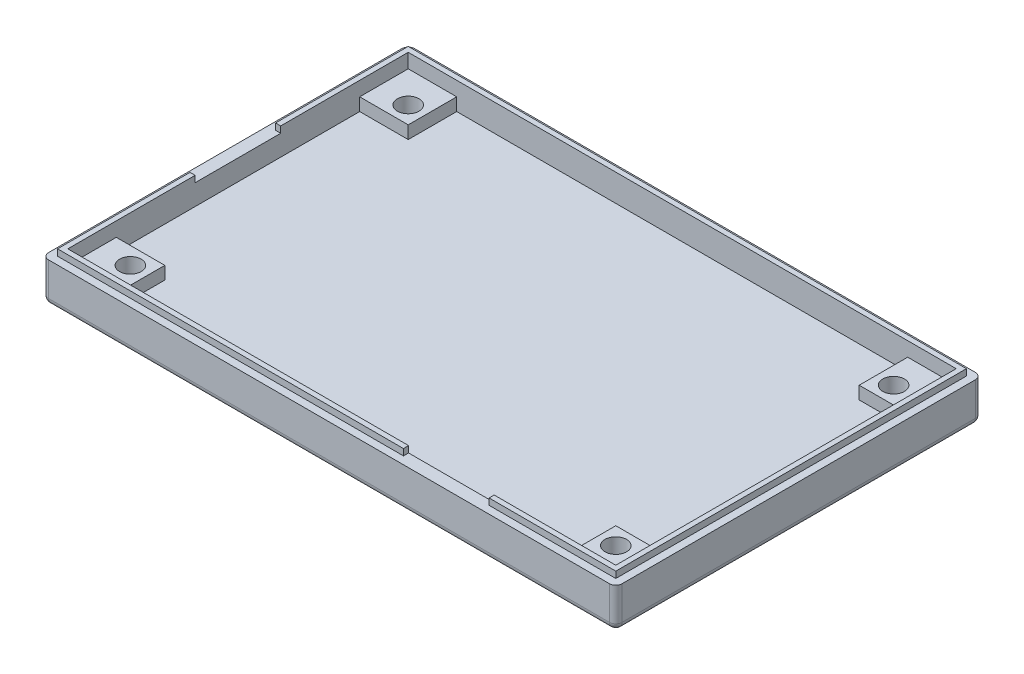
from build123d import *

# Parameters (mm, degrees)
SKETCH1_W               = 114.045996948
SKETCH1_H               = 72.771003052
SKETCH1_W_2             = 108.965996948
SKETCH1_H_2             = 67.691003052
BOSS_EXTRUDE1_DEPTH     = 5.3848
SKETCH2_W               = 114.045996948
SKETCH2_H               = 72.771003052
BOSS_EXTRUDE2_DEPTH     = 2.54
SKETCH3_W               = 9.64565
SKETCH3_H               = 9.645653052
BOSS_EXTRUDE3_DEPTH     = 3.81
CUT_EXTRUDE1_DEPTH      = 132.233284578
CUT_EXTRUDE1_DEPTH_BACK = 76.2
SKETCH4_R               = 2.1499957
SKETCH5_R               = 3.8735
CUT_EXTRUDE2_DEPTH      = 2.54
BOSS_EXTRUDE4_DEPTH     = 1.27
BOSS_EXTRUDE5_DEPTH     = 1.27
FILLET1_R               = 1.27


with BuildPart() as part:
    # Sketch1 → Boss-Extrude1 (new body)
    with BuildSketch(Plane(origin=(0, 0, 0), x_dir=(1, 0, 0), z_dir=(0, 1, 0))):
        with Locations((53.974998474, 33.337501526)):
            Rectangle(SKETCH1_W, SKETCH1_H)
        with Locations((53.974998474, 33.337501526)):
            Rectangle(SKETCH1_W_2, SKETCH1_H_2, mode=Mode.SUBTRACT)
    extrude(amount=BOSS_EXTRUDE1_DEPTH)

    # Sketch2 → Boss-Extrude2 (add)
    with BuildSketch(Plane.XZ):
        with Locations((53.974998474, -33.337501526)):
            Rectangle(SKETCH2_W, SKETCH2_H)
    extrude(amount=BOSS_EXTRUDE2_DEPTH)

    # Sketch3 → Boss-Extrude3 (add)
    with BuildSketch(Plane(origin=(0, 0, 0), x_dir=(1, 0, 0), z_dir=(0, 1, 0))):
        with Locations((4.314825, 62.360176526)):
            Rectangle(SKETCH3_W, SKETCH3_H)
        with Locations((103.635171948, 62.360176526)):
            Rectangle(SKETCH3_W, SKETCH3_H)
        with Locations((103.635171948, 4.314826526)):
            Rectangle(SKETCH3_W, SKETCH3_H)
        with Locations((4.314825, 4.314826526)):
            Rectangle(SKETCH3_W, SKETCH3_H)
    extrude(amount=BOSS_EXTRUDE3_DEPTH)

    # Sketch4 → Cut-Extrude1 (cut, two sides: drawn at the far end of the back side and taken through both)
    with BuildSketch(Plane(origin=(0, 3.81, 0), x_dir=(1, 0, 0), z_dir=(0, 1, 0)).offset(-CUT_EXTRUDE1_DEPTH_BACK)):
        with Locations(Location((5.715, 60.96, 0), (0, 0, 90))):
            Circle(SKETCH4_R)
        with Locations(Location((5.715, 5.715, 0), (0, 0, 90))):
            Circle(SKETCH4_R)
        with Locations(Location((102.235, 5.715, 0), (0, 0, 90))):
            Circle(SKETCH4_R)
        with Locations(Location((102.235, 60.96, 0), (0, 0, 90))):
            Circle(SKETCH4_R)
    extrude(amount=CUT_EXTRUDE1_DEPTH + CUT_EXTRUDE1_DEPTH_BACK, mode=Mode.SUBTRACT)

    # Sketch5 → Cut-Extrude2 (cut)
    with BuildSketch(Plane.XZ.offset(2.54)):
        with Locations(Location((5.715, -60.96, 0), (0, 0, 270))):
            Circle(SKETCH5_R)
        with Locations(Location((5.715, -5.715, 0), (0, 0, 270))):
            Circle(SKETCH5_R)
        with Locations(Location((102.235, -60.96, 0), (0, 0, 270))):
            Circle(SKETCH5_R)
        with Locations(Location((102.235, -5.715, 0), (0, 0, 270))):
            Circle(SKETCH5_R)
    extrude(amount=-CUT_EXTRUDE2_DEPTH, mode=Mode.SUBTRACT)

    # Sketch6 → Boss-Extrude4 (add)
    with BuildSketch(Plane(origin=(0, 0, 0), x_dir=(1, 0, 0), z_dir=(0, 1, 0))):
        Polygon((9.13765, 67.183003052), (98.812346948, 67.183003052), (98.812346948, 57.53735), (108.457996948, 57.53735), (108.457996948, 9.137653052), (98.812346948, 9.137653052), (98.812346948, -0.508), (9.13765, -0.508), (9.13765, 9.137653052), (-0.508, 9.137653052), (-0.508, 57.53735), (9.13765, 57.53735), align=None)
    extrude(amount=BOSS_EXTRUDE4_DEPTH)

    # Sketch7 → Boss-Extrude5 (add)
    with BuildSketch(Plane(origin=(0, 5.3848, 0), x_dir=(1, 0, 0), z_dir=(0, 1, 0))):
        Polygon((-0.508, 67.183003052), (108.457996948, 67.183003052), (108.457996948, -0.508), (84.272696176, -0.508), (84.272696176, -1.524), (109.473996948, -1.524), (109.473996948, 68.199003052), (-1.524, 68.199003052), (-1.524, 41.825543933), (-0.508, 41.825543933), align=None)
        Polygon((-0.508, -0.508), (-0.508, 24.809543933), (-1.524, 24.809543933), (-1.524, -1.524), (67.256696176, -1.524), (67.256696176, -0.508), align=None)
    extrude(amount=BOSS_EXTRUDE5_DEPTH)

    # Fillet1
    fillet1_edges = [part.edges().sort_by_distance(p)[0] for p in [
        (110.997996948, -2.54, -33.337501526),
        (53.974998474, -2.54, 3.048),
        (-3.048, -2.54, -33.337501526),
        (53.974998474, -2.54, -69.723003052),
        (-3.048, 1.4224, -69.723003052),
        (110.997996948, 1.4224, -69.723003052),
        (110.997996948, 1.4224, 3.048),
        (-3.048, 1.4224, 3.048),
    ]]
    fillet(fillet1_edges, radius=FILLET1_R)


solid = part.part
